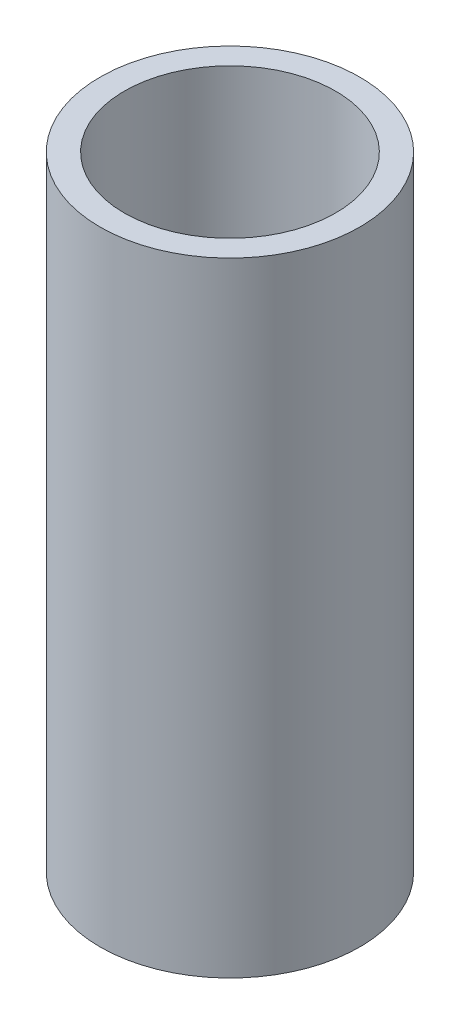
from build123d import *

# Parameters (mm, degrees)
SKETCH1_R           = 3.75
SKETCH1_R_2         = 3.05
BOSS_EXTRUDE1_DEPTH = 18


with BuildPart() as part:
    # Sketch1 → Boss-Extrude1 (new body)
    with BuildSketch(Plane(origin=(0, 0, 0), x_dir=(1, 0, 0), z_dir=(0, 1, 0))):
        with Locations(Location((0, 0, 0), (0, 0, 270))):
            Circle(SKETCH1_R)
        with Locations(Location((0, 0, 0), (0, 0, 270))):
            Circle(SKETCH1_R_2, mode=Mode.SUBTRACT)
    extrude(amount=BOSS_EXTRUDE1_DEPTH)


solid = part.part
